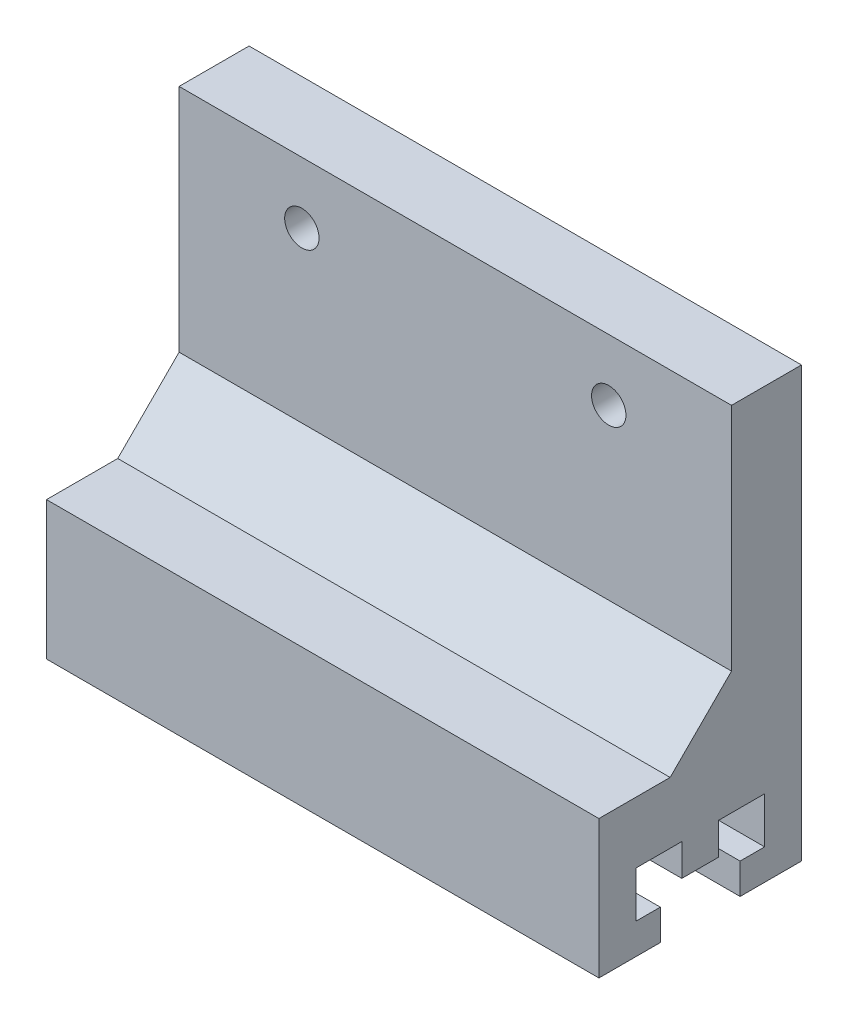
from build123d import *

# Parameters (mm, degrees)
BOSS_EXTRUDE1_DEPTH = 90
SKETCH3_W           = 90
SKETCH3_H           = 11.4
BOSS_EXTRUDE3_DEPTH = 47.5
SKETCH6_R           = 5.5
CUT_EXTRUDE3_DEPTH  = 5.5
SKETCH7_R           = 2.8
CUT_EXTRUDE4_DEPTH  = 10
BOSS_EXTRUDE4_DEPTH = 90


with BuildPart() as part:
    # Sketch1 → Boss-Extrude1 (new body)
    with BuildSketch(Plane(origin=(0, 0, 0), x_dir=(0, 0, -1), z_dir=(1, 0, 0))):
        Polygon((-16.5, 7.5), (16.5, 7.5), (16.5, -15), (6.5, -15), (6.5, -10), (10.5, -10), (10.5, -2.5), (3, -2.5), (3, -7.7), (-3, -7.7), (-3, -2.5), (-10.5, -2.5), (-10.5, -10), (-6.5, -10), (-6.5, -15), (-16.5, -15), align=None)
    extrude(amount=BOSS_EXTRUDE1_DEPTH)

    # Sketch3 → Boss-Extrude3 (add)
    with BuildSketch(Plane(origin=(0, 7.5, 0), x_dir=(1, 0, 0), z_dir=(0, 1, 0))):
        with Locations((45, 10.8)):
            Rectangle(SKETCH3_W, SKETCH3_H)
    extrude(amount=BOSS_EXTRUDE3_DEPTH)

    # Sketch6 → Cut-Extrude3 (cut)
    with BuildSketch(Plane(origin=(0, 0, -16.5), x_dir=(-1, 0, 0), z_dir=(0, 0, -1))):
        with Locations((-70, 45)):
            Circle(SKETCH6_R)
        with Locations((-20, 45)):
            Circle(SKETCH6_R)
    extrude(amount=-CUT_EXTRUDE3_DEPTH, mode=Mode.SUBTRACT)

    # Sketch7 → Cut-Extrude4 (cut)
    with BuildSketch(Plane(origin=(0, 0, -11), x_dir=(-1, 0, 0), z_dir=(0, 0, -1))):
        with Locations((-70, 45)):
            Circle(SKETCH7_R)
        with Locations((-20, 45)):
            Circle(SKETCH7_R)
    extrude(amount=-CUT_EXTRUDE4_DEPTH, mode=Mode.SUBTRACT)

    # Sketch11 → Boss-Extrude4 (add)
    with BuildSketch(Plane.ZY):
        Polygon((-5.1, 17.5), (4.9, 7.5), (-5.1, 7.5), align=None)
    extrude(amount=-BOSS_EXTRUDE4_DEPTH)


solid = part.part
